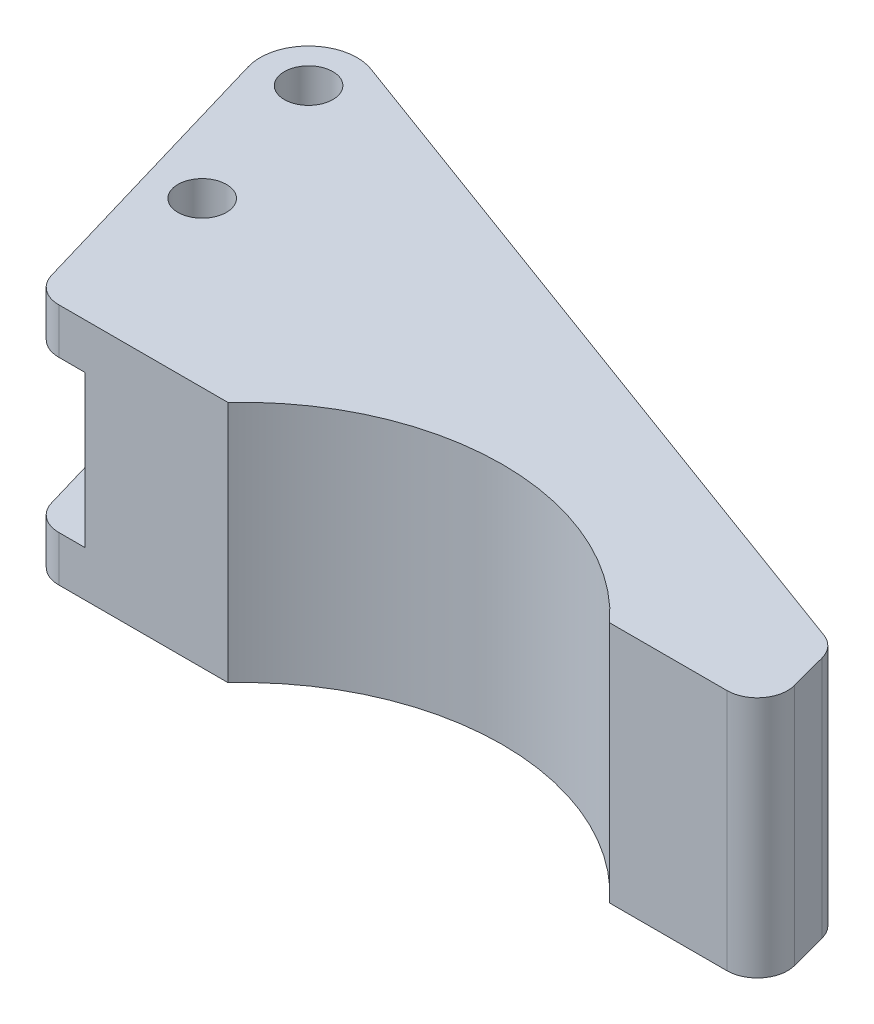
from build123d import *

# Parameters (mm, degrees)
SKETCH_1_R               = 4
EXTRUDE_1_DEPTH          = 20
CUT_EXTRUDE_1_DEPTH      = 138.563388298
CUT_EXTRUDE_1_DEPTH_BACK = 138.563388298
SKETCH_2_W               = 23
SKETCH_2_H               = 25


with BuildPart() as part:
    # 草图1 → 凸台-拉伸1 (new, symmetric)
    with BuildSketch(Plane(origin=(0, 0, 0), x_dir=(1, 0, 0), z_dir=(0, 1, 0))):
        with BuildLine():
            Line((-7.673488412, -2.262205913), (5.894069743, -48.283878695))
            ThreePointArc((5.894069743, -48.283878695), (7.695788374, -50.874334744), (10.69, -51.87))
            Line((10.69, -51.87), (38.585207042, -51.87))
            ThreePointArc((38.585207042, -51.87), (70.04, -38.09), (101.494792958, -51.87))
            Line((101.494792958, -51.87), (120.83, -51.87))
            ThreePointArc((120.83, -51.87), (124.79417955, -49.917175823), (125.661820833, -45.584112198))
            Line((125.661820833, -45.584112198), (124.011820833, -39.384112198))
            ThreePointArc((124.011820833, -39.384112198), (122.875351803, -37.301858813), (120.907082582, -35.97775259))
            Line((120.907082582, -35.97775259), (2.763332132, 7.507595856))
            ThreePointArc((2.763332132, 7.507595856), (-5.467144165, 5.840405352), (-7.673488412, -2.262205913))
        make_face()
        with Locations(Location((0, 0, 0), (0, 0, 270))):
            Circle(SKETCH_1_R, mode=Mode.SUBTRACT)
        with Locations(Location((7.33, -24.87, 0), (0, 0, 270))):
            Circle(SKETCH_1_R, mode=Mode.SUBTRACT)
    extrude(amount=EXTRUDE_1_DEPTH, both=True)

    # 草图2 → 切除-拉伸1 (cut, two sides: drawn at the far end of the back side and taken through both)
    with BuildSketch(Plane.XY.offset(-CUT_EXTRUDE_1_DEPTH_BACK)):
        with Locations((3.5, 0)):
            Rectangle(SKETCH_2_W, SKETCH_2_H)
    extrude(amount=CUT_EXTRUDE_1_DEPTH + CUT_EXTRUDE_1_DEPTH_BACK, mode=Mode.SUBTRACT)


solid = part.part
